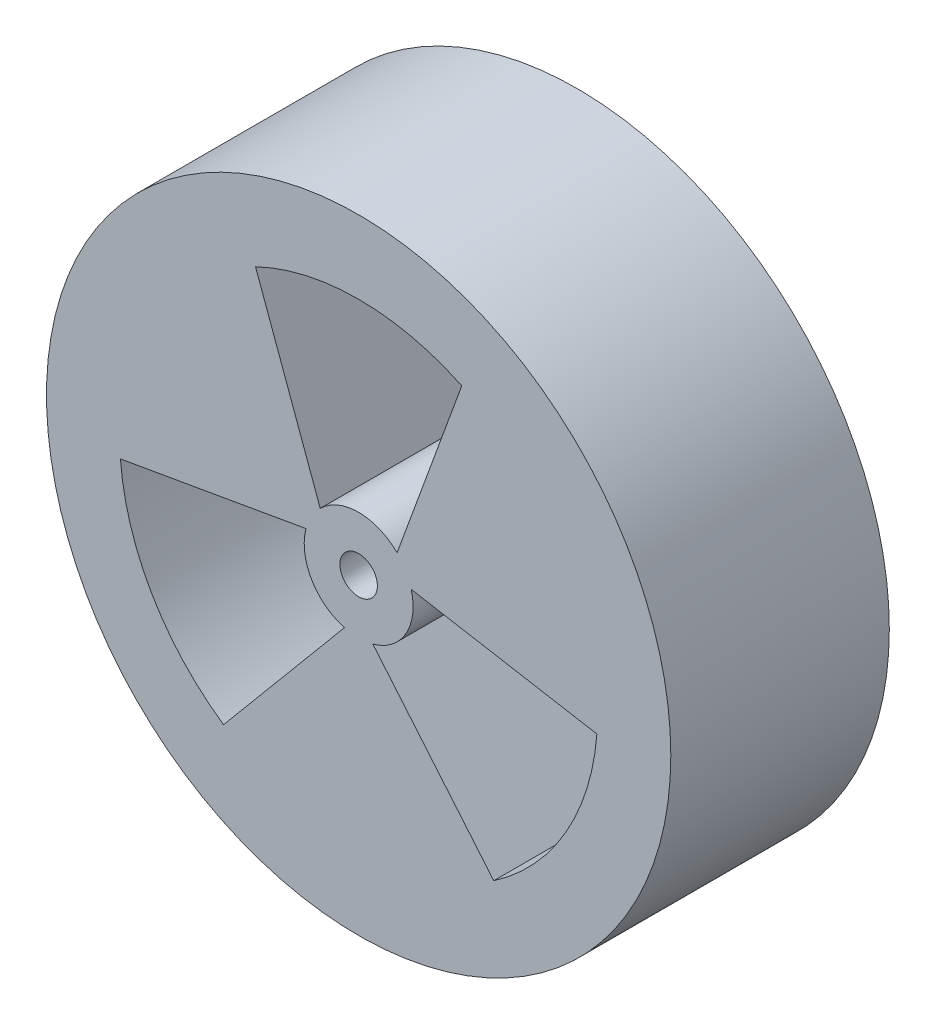
from build123d import *

# Parameters (mm, degrees)
SKETCH1_R            = 50
SKETCH1_R_2          = 3
BOSS_EXTRUDE1_DEPTH  = 35
CUT_EXTRUDE1_DEPTH   = 35
CIRPATTERN6_COUNT    = 3
MIRROR2_COPY_1_DEPTH = 35
MIRROR2_COPY_2_DEPTH = 35


with BuildPart() as part:
    # Sketch1 → Boss-Extrude1 (new body)
    with BuildSketch(Plane.XY):
        Circle(SKETCH1_R)
        Circle(SKETCH1_R_2, mode=Mode.SUBTRACT)
    extrude(amount=BOSS_EXTRUDE1_DEPTH)

    # Sketch3 → Cut-Extrude1 (cut)
    with BuildSketch(Plane.XY.offset(35)):
        with BuildLine():
            Line((0, 38.272172541), (0, 8.722907964))
            ThreePointArc((0, 8.722907964), (-3.329803479, 8.062352767), (-6.155298303, 6.180730228))
            Line((-6.155298303, 6.180730228), (-16.518963046, 34.523659292))
            ThreePointArc((-16.518963046, 34.523659292), (-8.469467098, 37.323281181), (0, 38.272172541))
        make_face()
    cut_extrude1 = extrude(amount=-CUT_EXTRUDE1_DEPTH, mode=Mode.SUBTRACT)

    # Mirror1: Cut-Extrude1 across plane
    add(cut_extrude1.mirror(Plane(origin=(0, 38.272172541, 0), x_dir=(0, 0, 1), z_dir=(1, 0, 0))), mode=Mode.SUBTRACT)

    # CirPattern6: Cut-Extrude1 ×3 about axis
    cirpattern6_axis = Axis((0, 0, 0), (0, 0, 1))
    for i in range(1, CIRPATTERN6_COUNT):
        add(cut_extrude1.rotate(cirpattern6_axis, i * 360 / CIRPATTERN6_COUNT), mode=Mode.SUBTRACT)

    # Mirror2: Cut-Extrude1 across plane
    add(cut_extrude1.mirror(Plane(origin=(33.144673679, -19.136086271, 0), x_dir=(0, 0, 1), z_dir=(-0.5000000000000041, -0.8660254037844364, 0))), mode=Mode.SUBTRACT)

    # Mirror2 copy 1 sketch → Mirror2 copy 1 (cut)
    with BuildSketch(Plane(origin=(0, 0, 35), x_dir=(-1, 0, 0), z_dir=(0, 0, 1))):
        with BuildLine():
            Line((0, -38.272172541), (0, -8.722907964))
            ThreePointArc((0, -8.722907964), (-3.329803479, -8.062352767), (-6.155298303, -6.180730228))
            Line((-6.155298303, -6.180730228), (-16.518963046, -34.523659292))
            ThreePointArc((-16.518963046, -34.523659292), (-8.469467098, -37.323281181), (0, -38.272172541))
        make_face()
    extrude(amount=-MIRROR2_COPY_1_DEPTH, mode=Mode.SUBTRACT)

    # Mirror2 copy 2 sketch → Mirror2 copy 2 (cut)
    with BuildSketch(Plane(origin=(0, 0, 35), x_dir=(0.5000000000000079, 0.8660254037844346, 0), z_dir=(0, 0, 1))):
        with BuildLine():
            Line((0, -38.272172541), (0, -8.722907964))
            ThreePointArc((0, -8.722907964), (-3.329803479, -8.062352767), (-6.155298303, -6.180730228))
            Line((-6.155298303, -6.180730228), (-16.518963046, -34.523659292))
            ThreePointArc((-16.518963046, -34.523659292), (-8.469467098, -37.323281181), (0, -38.272172541))
        make_face()
    extrude(amount=-MIRROR2_COPY_2_DEPTH, mode=Mode.SUBTRACT)


solid = part.part
